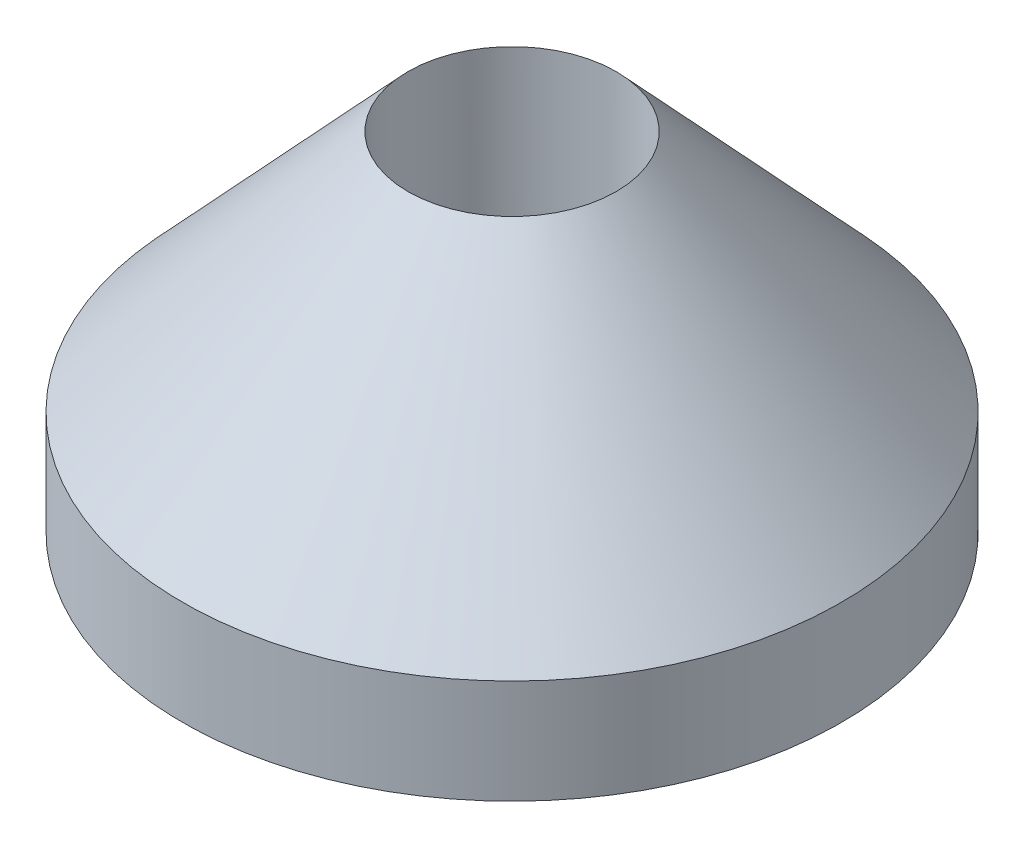
from build123d import *

# Parameters (mm, degrees)
SKETCH2_R          = 3
CUT_EXTRUDE1_DEPTH = 7


with BuildPart() as part:
    # Sketch1 → Revolve1 (revolve)
    with BuildSketch(Plane.XY, mode=Mode.PRIVATE) as revolve1_sk:
        Polygon((0, 0.587634079), (0, 10.587634079), (3, 10.587634079), (9.5, 3.587634079), (9.5, 0.587634079), align=None)
    revolve(revolve1_sk.sketch.rotate(Axis((0, 0.587634079, 0), (0, 1, 0)), 90), axis=Axis((0, 0.587634079, 0), (0, 1, 0)))

    # Sketch2 → Cut-Extrude1 (cut)
    with BuildSketch(Plane(origin=(0, 10.587634079, 0), x_dir=(1, 0, 0), z_dir=(0, 1, 0))):
        with Locations(Location((0, 0, 0), (0, 0, 270))):
            Circle(SKETCH2_R)
    extrude(amount=-CUT_EXTRUDE1_DEPTH, mode=Mode.SUBTRACT)


solid = part.part
